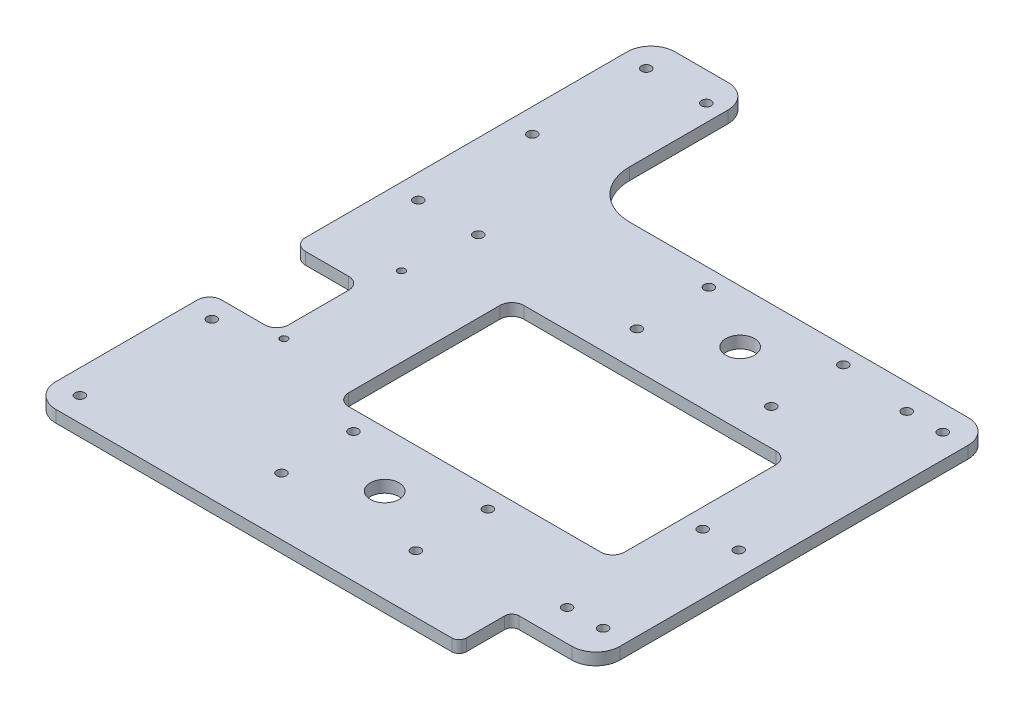
from build123d import *

# Parameters (mm, degrees)
SKETCH_1_W          = 213
SKETCH_1_H          = 200
EXTRUDE_1_DEPTH     = 5
SKETCH_2_R          = 2
SKETCH_2_R_2        = 6
CUT_EXTRUDE_1_DEPTH = 147.175408328
SKETCH_3_W          = 213
SKETCH_3_H          = 12.904797871
CUT_EXTRUDE_2_DEPTH = 147.175408328
SKETCH_4_W          = 28
SKETCH_4_H          = 35
CUT_EXTRUDE_3_DEPTH = 147.175408328
FILLET_1_R          = 5
SKETCH_5_W          = 42
SKETCH_5_H          = 70.904797871
EXTRUDE_2_DEPTH     = 5
FILLET_2_R          = 20
SKETCH_6_R          = 2
CUT_EXTRUDE_4_DEPTH = 202.434108173
SKETCH_7_R          = 2
CUT_EXTRUDE_5_DEPTH = 202.434108173
SKETCH_8_W          = 20
SKETCH_8_H          = 22
CUT_EXTRUDE_6_DEPTH = 202.434108173
FILLET_3_R          = 3
SKETCH_9_W          = 18
SKETCH_9_H          = 22
CUT_EXTRUDE_7_DEPTH = 202.434108173
SKETCH_10_R         = 1.5
CUT_EXTRUDE_8_DEPTH = 202.434108173
FILLET_4_R          = 10
SKETCH_11_W         = 115
SKETCH_11_H         = 73
CUT_EXTRUDE_9_DEPTH = 202.434108173
FILLET_5_R          = 5


with BuildPart() as part:
    # 草图1 → 凸台-拉伸1 (new body)
    with BuildSketch(Plane(origin=(0, 0, 0), x_dir=(1, 0, 0), z_dir=(0, 1, 0))):
        Rectangle(SKETCH_1_W, SKETCH_1_H)
    extrude(amount=EXTRUDE_1_DEPTH)

    # 草图2 → 切除-拉伸1 (cut, through all)
    with BuildSketch(Plane(origin=(0, 5, 0), x_dir=(1, 0, 0), z_dir=(0, 1, 0))):
        with Locations(Location((-4.5, 93, 0), (0, 0, 270))):
            Circle(SKETCH_2_R)
        with Locations(Location((51.5, 93, 0), (0, 0, 270))):
            Circle(SKETCH_2_R)
        with Locations(Location((-4.5, 63, 0), (0, 0, 270))):
            Circle(SKETCH_2_R)
        with Locations(Location((51.5, 63, 0), (0, 0, 270))):
            Circle(SKETCH_2_R)
        with Locations(Location((-26.5, -33.095202129, 0), (0, 0, 270))):
            Circle(SKETCH_2_R)
        with Locations(Location((29.5, -33.095202129, 0), (0, 0, 270))):
            Circle(SKETCH_2_R)
        with Locations(Location((29.5, -63.095202129, 0), (0, 0, 270))):
            Circle(SKETCH_2_R)
        with Locations(Location((-26.5, -63.095202129, 0), (0, 0, 270))):
            Circle(SKETCH_2_R)
        with Locations(Location((1.5, -48.095202129, 0), (0, 0, 270))):
            Circle(SKETCH_2_R_2)
        with Locations(Location((23.5, 78, 0), (0, 0, 270))):
            Circle(SKETCH_2_R_2)
    extrude(amount=-CUT_EXTRUDE_1_DEPTH, mode=Mode.SUBTRACT)

    # 草图3 → 切除-拉伸2 (cut, through all)
    with BuildSketch(Plane(origin=(0, 5, 0), x_dir=(1, 0, 0), z_dir=(0, 1, 0))):
        with Locations((0, -93.547601065)):
            Rectangle(SKETCH_3_W, SKETCH_3_H)
    extrude(amount=-CUT_EXTRUDE_2_DEPTH, mode=Mode.SUBTRACT)

    # 草图4 → 切除-拉伸3 (cut, through all)
    with BuildSketch(Plane(origin=(0, 5, 0), x_dir=(1, 0, 0), z_dir=(0, 1, 0))):
        with Locations((-92.5, 4.404797871)):
            Rectangle(SKETCH_4_W, SKETCH_4_H)
    extrude(amount=-CUT_EXTRUDE_3_DEPTH, mode=Mode.SUBTRACT)

    # 圆角1
    fillet_1_edges = [part.edges().sort_by_distance(p)[0] for p in [
        (-106.5, 2.5, 13.095202129),
        (-106.5, 2.5, -21.904797871),
        (-78.5, 2.5, -21.904797871),
        (-78.5, 2.5, 13.095202129),
    ]]
    fillet(fillet_1_edges, radius=FILLET_1_R)

    # 草图5 → 凸台-拉伸2 (add)
    with BuildSketch(Plane(origin=(0, 5, 0), x_dir=(1, 0, 0), z_dir=(0, 1, 0))):
        with Locations((-85.5, 135.452398936)):
            Rectangle(SKETCH_5_W, SKETCH_5_H)
    extrude(amount=-EXTRUDE_2_DEPTH)

    # 圆角2
    fillet_2_edges = [part.edges().sort_by_distance(p)[0] for p in [
        (-64.5, 2.5, -100),
    ]]
    fillet(fillet_2_edges, radius=FILLET_2_R)

    # 草图6 → 切除-拉伸4 (cut, through all)
    with BuildSketch(Plane(origin=(0, 5, 0), x_dir=(1, 0, 0), z_dir=(0, 1, 0))):
        with Locations(Location((-96.5, 158.904797871, 0), (0, 0, 270))):
            Circle(SKETCH_6_R)
        with Locations(Location((-71.5, 158.904797871, 0), (0, 0, 270))):
            Circle(SKETCH_6_R)
        with Locations(Location((-71.5, 63.904797871, 0), (0, 0, 270))):
            Circle(SKETCH_6_R)
        with Locations(Location((-96.5, 63.904797871, 0), (0, 0, 270))):
            Circle(SKETCH_6_R)
    extrude(amount=-CUT_EXTRUDE_4_DEPTH, mode=Mode.SUBTRACT)

    # 草图7 → 切除-拉伸5 (cut, through all)
    with BuildSketch(Plane(origin=(0, 5, 0), x_dir=(1, 0, 0), z_dir=(0, 1, 0))):
        with Locations(Location((-96.5, 111.404797871, 0), (0, 0, 270))):
            Circle(SKETCH_7_R)
        with Locations(Location((-96.5, -22.095202129, 0), (0, 0, 270))):
            Circle(SKETCH_7_R)
        with Locations(Location((-96.5, -77.095202129, 0), (0, 0, 270))):
            Circle(SKETCH_7_R)
        with Locations(Location((96.5, -52.095202129, 0), (0, 0, 270))):
            Circle(SKETCH_7_R)
        with Locations(Location((96.5, 4.404797871, 0), (0, 0, 270))):
            Circle(SKETCH_7_R)
        with Locations(Location((96.5, 89.404797871, 0), (0, 0, 270))):
            Circle(SKETCH_7_R)
        with Locations(Location((81.5, 89.404797871, 0), (0, 0, 270))):
            Circle(SKETCH_7_R)
        with Locations(Location((81.5, 4.404797871, 0), (0, 0, 270))):
            Circle(SKETCH_7_R)
        with Locations(Location((81.5, -52.095202129, 0), (0, 0, 270))):
            Circle(SKETCH_7_R)
    extrude(amount=-CUT_EXTRUDE_5_DEPTH, mode=Mode.SUBTRACT)

    # 草图8 → 切除-拉伸6 (cut, through all)
    with BuildSketch(Plane(origin=(0, 5, 0), x_dir=(1, 0, 0), z_dir=(0, 1, 0))):
        with Locations((81.5, -76.095202129)):
            Rectangle(SKETCH_8_W, SKETCH_8_H)
    extrude(amount=-CUT_EXTRUDE_6_DEPTH, mode=Mode.SUBTRACT)

    # 圆角3
    fillet_3_edges = [part.edges().sort_by_distance(p)[0] for p in [
        (91.5, 2.5, 87.095202129),
        (71.5, 2.5, 87.095202129),
        (71.5, 2.5, 65.095202129),
        (91.5, 2.5, 65.095202129),
    ]]
    fillet(fillet_3_edges, radius=FILLET_3_R)

    # 草图9 → 切除-拉伸7 (cut, through all)
    with BuildSketch(Plane(origin=(0, 5, 0), x_dir=(1, 0, 0), z_dir=(0, 1, 0))):
        with Locations((97.5, -76.095202129)):
            Rectangle(SKETCH_9_W, SKETCH_9_H)
    extrude(amount=-CUT_EXTRUDE_7_DEPTH, mode=Mode.SUBTRACT)

    # 草图10 → 切除-拉伸8 (cut, through all)
    with BuildSketch(Plane(origin=(0, 5, 0), x_dir=(1, 0, 0), z_dir=(0, 1, 0))):
        with Locations(Location((-74.5, 34.904797871, 0), (0, 0, 270))):
            Circle(SKETCH_10_R)
        with Locations(Location((-74.5, -14.095202129, 0), (0, 0, 270))):
            Circle(SKETCH_10_R)
    extrude(amount=-CUT_EXTRUDE_8_DEPTH, mode=Mode.SUBTRACT)

    # 圆角4
    fillet_4_edges = [part.edges().sort_by_distance(p)[0] for p in [
        (-106.5, 2.5, -170.904797871),
        (-64.5, 2.5, -170.904797871),
        (106.5, 2.5, 65.095202129),
        (-106.5, 2.5, 87.095202129),
        (106.5, 2.5, -100),
    ]]
    fillet(fillet_4_edges, radius=FILLET_4_R)

    # 草图11 → 切除-拉伸9 (cut, through all)
    with BuildSketch(Plane(origin=(0, 5, 0), x_dir=(1, 0, 0), z_dir=(0, 1, 0))):
        with Locations((16, 11.404797871)):
            Rectangle(SKETCH_11_W, SKETCH_11_H)
    extrude(amount=-CUT_EXTRUDE_9_DEPTH, mode=Mode.SUBTRACT)

    # 圆角5
    fillet_5_edges = [part.edges().sort_by_distance(p)[0] for p in [
        (-41.5, 2.5, 25.095202129),
        (-41.5, 2.5, -47.904797871),
        (73.5, 2.5, -47.904797871),
        (73.5, 2.5, 25.095202129),
    ]]
    fillet(fillet_5_edges, radius=FILLET_5_R)


solid = part.part
